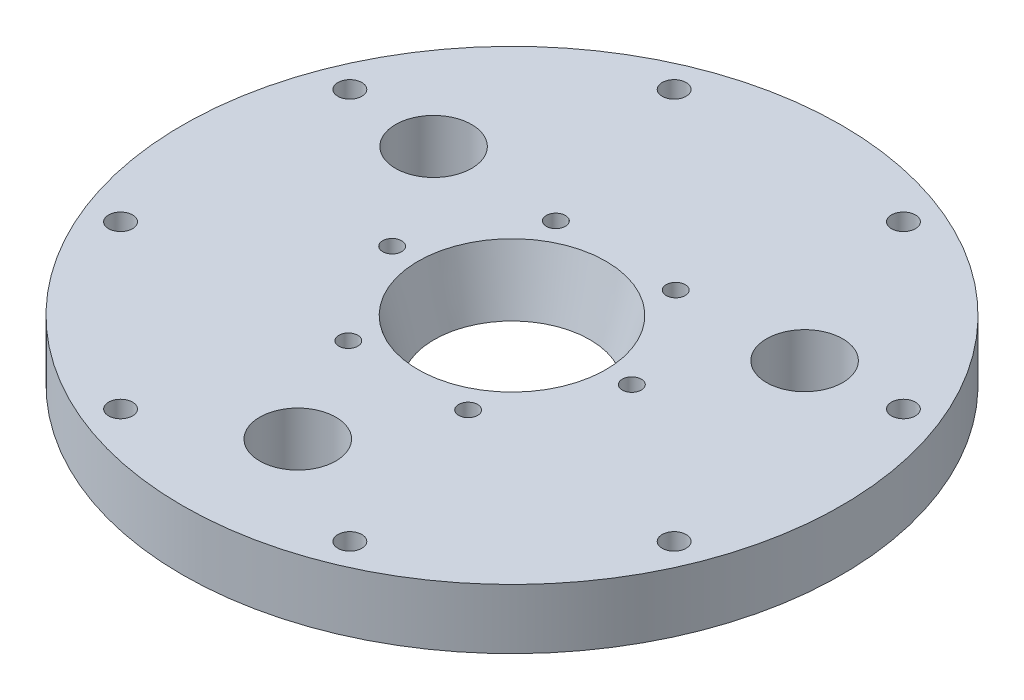
from build123d import *

# Parameters (mm, degrees)
SKETCH1_R           = 55
BOSS_EXTRUDE1_DEPTH = 10
SKETCH6_R           = 2
CUT_EXTRUDE3_DEPTH  = 79.421935707
CIRPATTERN1_COUNT   = 8
SKETCH7_R           = 6.35
CUT_EXTRUDE4_DEPTH  = 79.421935707
CIRPATTERN2_COUNT   = 3
SKETCH8_R           = 1.5875
CUT_EXTRUDE5_DEPTH  = 7
CIRPATTERN3_COUNT   = 6


with BuildPart() as part:
    # Sketch1 → Boss-Extrude1 (new body)
    with BuildSketch(Plane(origin=(0, 0, 0), x_dir=(1, 0, 0), z_dir=(0, 1, 0))):
        with Locations(Location((0, 0, 0), (0, 0, 270))):
            Circle(SKETCH1_R)
    extrude(amount=BOSS_EXTRUDE1_DEPTH)

    # Sketch5 → Cut-Revolve1 (revolve, cut)
    with BuildSketch(Plane.XY, mode=Mode.PRIVATE) as cut_revolve1_sk:
        Polygon((0, 0), (0, 10), (15.679491924, 10), (13, 0), align=None)
    revolve(cut_revolve1_sk.sketch.rotate(Axis((0, 0, 0), (0, 1, 0)), 90), axis=Axis((0, 0, 0), (0, 1, 0)), mode=Mode.SUBTRACT)

    # Sketch6 → Cut-Extrude3 (cut, through all)
    with BuildSketch(Plane(origin=(0, 0, 0), x_dir=(1, 0, 0), z_dir=(0, 1, 0))):
        with Locations(Location((46.193976626, 19.134171618, 0), (0, 0, 270))):
            Circle(SKETCH6_R)
    cut_extrude3 = extrude(amount=CUT_EXTRUDE3_DEPTH, mode=Mode.SUBTRACT)

    # CirPattern1: Cut-Extrude3 ×8 about axis
    cirpattern1_axis = Axis((0, 0, 0), (0, 1, 0))
    for i in range(1, CIRPATTERN1_COUNT):
        add(cut_extrude3.rotate(cirpattern1_axis, i * 360 / CIRPATTERN1_COUNT), mode=Mode.SUBTRACT)

    # Sketch7 → Cut-Extrude4 (cut, through all)
    with BuildSketch(Plane(origin=(0, 10, 0), x_dir=(1, 0, 0), z_dir=(0, 1, 0))):
        with Locations(Location((30.960408185, 17.875, 0), (0, 0, 270))):
            Circle(SKETCH7_R)
    cut_extrude4 = extrude(amount=-CUT_EXTRUDE4_DEPTH, mode=Mode.SUBTRACT)

    # CirPattern2: Cut-Extrude4 ×3 about axis
    cirpattern2_axis = Axis((0, 0, 0), (0, 1, 0))
    for i in range(1, CIRPATTERN2_COUNT):
        add(cut_extrude4.rotate(cirpattern2_axis, i * 360 / CIRPATTERN2_COUNT), mode=Mode.SUBTRACT)

    # Sketch8 → Cut-Extrude5 (cut)
    with BuildSketch(Plane(origin=(0, 10, 0), x_dir=(1, 0, 0), z_dir=(0, 1, 0))):
        with Locations(Location((20, 0, 0), (0, 0, 270))):
            Circle(SKETCH8_R)
    cut_extrude5 = extrude(amount=-CUT_EXTRUDE5_DEPTH, mode=Mode.SUBTRACT)

    # CirPattern3: Cut-Extrude5 ×6 about axis
    cirpattern3_axis = Axis((0, 0, 0), (0, 1, 0))
    for i in range(1, CIRPATTERN3_COUNT):
        add(cut_extrude5.rotate(cirpattern3_axis, i * 360 / CIRPATTERN3_COUNT), mode=Mode.SUBTRACT)


solid = part.part
